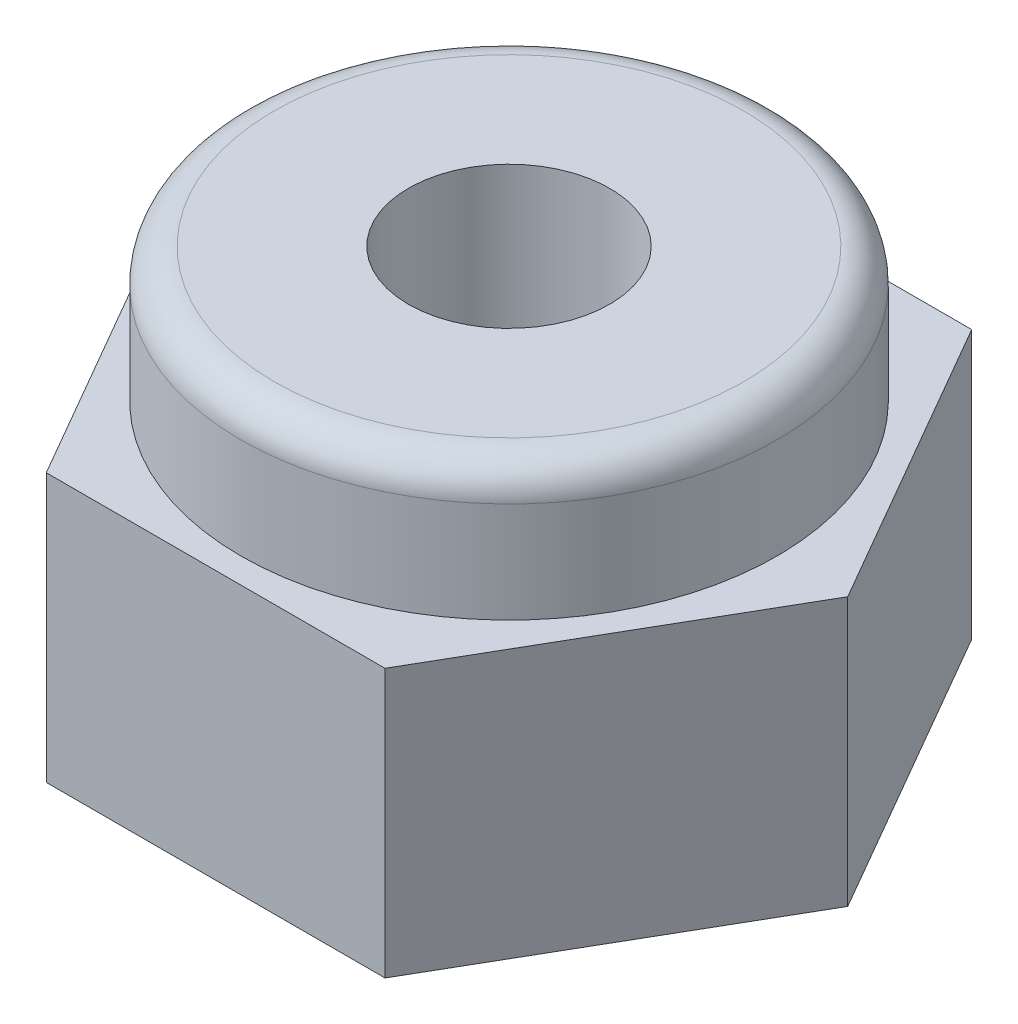
from build123d import *

# Parameters (mm, degrees)
SKETCH1_R           = 1.5
BOSS_EXTRUDE1_DEPTH = 4
SKETCH2_R           = 4
SKETCH2_R_2         = 1.5
BOSS_EXTRUDE2_DEPTH = 2
FILLET1_R           = 0.5


with BuildPart() as part:
    # Sketch1 → Boss-Extrude1 (new body)
    with BuildSketch(Plane(origin=(0, 0, 0), x_dir=(1, 0, 0), z_dir=(0, 1, 0))):
        Polygon((2.525907428, 4.375), (-2.525907428, 4.375), (-5.051814855, 0), (-2.525907428, -4.375), (2.525907428, -4.375), (5.051814855, 0), align=None)
        with Locations(Location((0, 0, 0), (0, 0, 270))):
            Circle(SKETCH1_R, mode=Mode.SUBTRACT)
    extrude(amount=BOSS_EXTRUDE1_DEPTH)

    # Sketch2 → Boss-Extrude2 (add)
    with BuildSketch(Plane(origin=(0, 4, 0), x_dir=(1, 0, 0), z_dir=(0, 1, 0))):
        with Locations(Location((0, 0, 0), (0, 0, 270))):
            Circle(SKETCH2_R)
        with Locations(Location((0, 0, 0), (0, 0, 270))):
            Circle(SKETCH2_R_2, mode=Mode.SUBTRACT)
    extrude(amount=BOSS_EXTRUDE2_DEPTH)

    # Fillet1
    fillet1_edges = [part.edges().sort_by_distance(p)[0] for p in [
        (0, 6, -4),
    ]]
    fillet(fillet1_edges, radius=FILLET1_R)


solid = part.part
